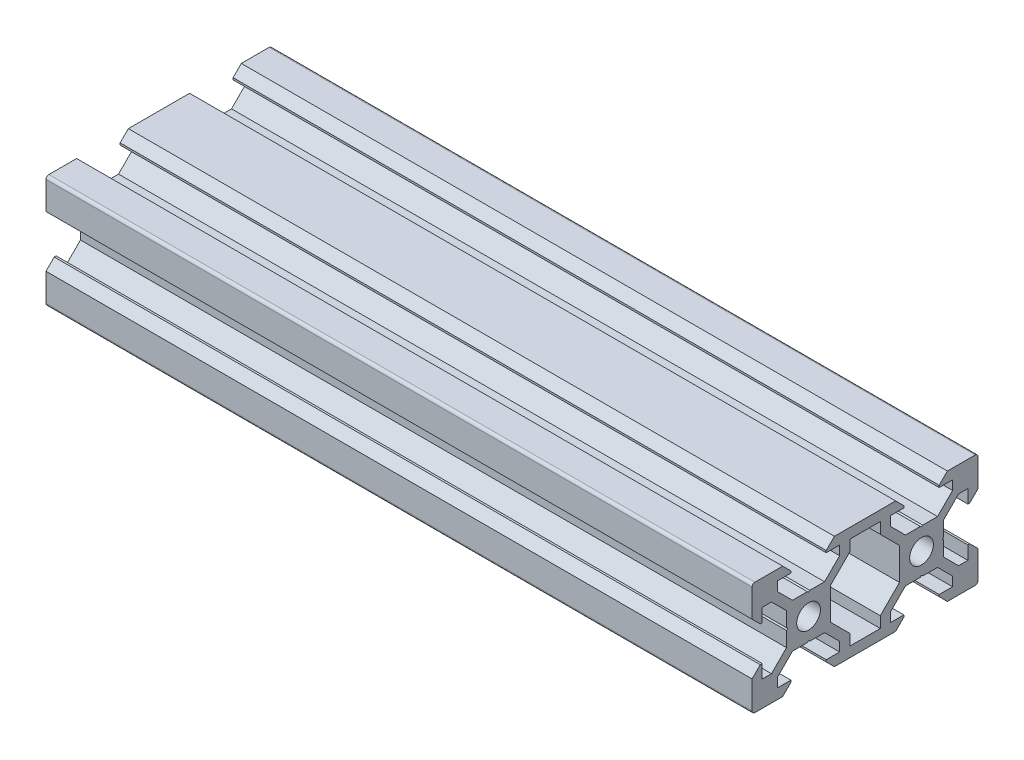
from build123d import *

# Parameters (mm, degrees)
PROFILE_SKETCH_R      = 2.1
PROFILE_EXTRUDE_DEPTH = 125


with BuildPart() as part:
    # Profile Sketch → Profile Extrude (new body)
    with BuildSketch(Plane(origin=(0, 0, 0), x_dir=(0, 0, -1), z_dir=(1, 0, 0))):
        with BuildLine():
            Line((5.42, 10), (-5.42, 10))
            Line((-5.42, 10), (-6.875, 8.545))
            Line((-6.875, 8.545), (-6.875, 8.2))
            Line((-6.875, 8.2), (-4.5, 8.2))
            Line((-4.5, 8.2), (-4.5, 6.56))
            Line((-4.5, 6.56), (-7.16, 3.9))
            Line((-7.16, 3.9), (-9.79, 3.9))
            Line((-9.79, 3.9), (-10, 3.69))
            Line((-10, 3.69), (-10.21, 3.9))
            Line((-10.21, 3.9), (-12.84, 3.9))
            Line((-12.84, 3.9), (-15.5, 6.56))
            Line((-15.5, 6.56), (-15.5, 8.2))
            Line((-15.5, 8.2), (-13.125, 8.2))
            Line((-13.125, 8.2), (-13.125, 8.545))
            Line((-13.125, 8.545), (-14.58, 10))
            Line((-14.58, 10), (-19.5, 10))
            ThreePointArc((-19.5, 10), (-19.853553391, 9.853553391), (-20, 9.5))
            Line((-20, 9.5), (-20, 4.58))
            Line((-20, 4.58), (-18.545, 3.125))
            Line((-18.545, 3.125), (-18.2, 3.125))
            Line((-18.2, 3.125), (-18.2, 5.5))
            Line((-18.2, 5.5), (-16.56, 5.5))
            Line((-16.56, 5.5), (-13.9, 2.838679656))
            Line((-13.9, 2.838679656), (-13.9, 0.21))
            Line((-13.9, 0.21), (-13.69, 0))
            Line((-13.69, 0), (-13.9, -0.21))
            Line((-13.9, -0.21), (-13.9, -2.838679656))
            Line((-13.9, -2.838679656), (-16.56, -5.5))
            Line((-16.56, -5.5), (-18.2, -5.5))
            Line((-18.2, -5.5), (-18.2, -3.125))
            Line((-18.2, -3.125), (-18.545, -3.125))
            Line((-18.545, -3.125), (-20, -4.58))
            Line((-20, -4.58), (-20, -9.5))
            ThreePointArc((-20, -9.5), (-19.853553391, -9.853553391), (-19.5, -10))
            Line((-19.5, -10), (-14.58, -10))
            Line((-14.58, -10), (-13.125, -8.545))
            Line((-13.125, -8.545), (-13.125, -8.2))
            Line((-13.125, -8.2), (-15.5, -8.2))
            Line((-15.5, -8.2), (-15.5, -6.56))
            Line((-15.5, -6.56), (-12.84, -3.9))
            Line((-12.84, -3.9), (-10.21, -3.9))
            Line((-10.21, -3.9), (-10, -3.69))
            Line((-10, -3.69), (-9.79, -3.9))
            Line((-9.79, -3.9), (-7.16, -3.9))
            Line((-7.16, -3.9), (-4.5, -6.56))
            Line((-4.5, -6.56), (-4.5, -8.2))
            Line((-4.5, -8.2), (-6.875, -8.2))
            Line((-6.875, -8.2), (-6.875, -8.545))
            Line((-6.875, -8.545), (-5.42, -10))
            Line((-5.42, -10), (5.42, -10))
            Line((5.42, -10), (6.875, -8.545))
            Line((6.875, -8.545), (6.875, -8.2))
            Line((6.875, -8.2), (4.5, -8.2))
            Line((4.5, -8.2), (4.5, -6.56))
            Line((4.5, -6.56), (7.16, -3.9))
            Line((7.16, -3.9), (9.79, -3.9))
            Line((9.79, -3.9), (10, -3.69))
            Line((10, -3.69), (10.21, -3.9))
            Line((10.21, -3.9), (12.84, -3.9))
            Line((12.84, -3.9), (15.5, -6.56))
            Line((15.5, -6.56), (15.5, -8.2))
            Line((15.5, -8.2), (13.125, -8.2))
            Line((13.125, -8.2), (13.125, -8.545))
            Line((13.125, -8.545), (14.58, -10))
            Line((14.58, -10), (19.5, -10))
            ThreePointArc((19.5, -10), (19.853553391, -9.853553391), (20, -9.5))
            Line((20, -9.5), (20, -4.58))
            Line((20, -4.58), (18.545, -3.125))
            Line((18.545, -3.125), (18.2, -3.125))
            Line((18.2, -3.125), (18.2, -5.5))
            Line((18.2, -5.5), (16.56, -5.5))
            Line((16.56, -5.5), (13.9, -2.838679656))
            Line((13.9, -2.838679656), (13.9, -0.21))
            Line((13.9, -0.21), (13.69, 0))
            Line((13.69, 0), (13.9, 0.21))
            Line((13.9, 0.21), (13.9, 2.838679656))
            Line((13.9, 2.838679656), (16.56, 5.5))
            Line((16.56, 5.5), (18.2, 5.5))
            Line((18.2, 5.5), (18.2, 3.125))
            Line((18.2, 3.125), (18.545, 3.125))
            Line((18.545, 3.125), (20, 4.58))
            Line((20, 4.58), (20, 9.5))
            ThreePointArc((20, 9.5), (19.853553391, 9.853553391), (19.5, 10))
            Line((19.5, 10), (14.58, 10))
            Line((14.58, 10), (13.125, 8.545))
            Line((13.125, 8.545), (13.125, 8.2))
            Line((13.125, 8.2), (15.5, 8.2))
            Line((15.5, 8.2), (15.5, 6.56))
            Line((15.5, 6.56), (12.84, 3.9))
            Line((12.84, 3.9), (10.21, 3.9))
            Line((10.21, 3.9), (10, 3.69))
            Line((10, 3.69), (9.79, 3.9))
            Line((9.79, 3.9), (7.16, 3.9))
            Line((7.16, 3.9), (4.5, 6.56))
            Line((4.5, 6.56), (4.5, 8.2))
            Line((4.5, 8.2), (6.875, 8.2))
            Line((6.875, 8.2), (6.875, 8.545))
            Line((6.875, 8.545), (5.42, 10))
        make_face()
        with Locations((-10, 0)):
            Circle(PROFILE_SKETCH_R, mode=Mode.SUBTRACT)
        with Locations((10, 0)):
            Circle(PROFILE_SKETCH_R, mode=Mode.SUBTRACT)
        Polygon((2.7, 8.2), (-2.7, 8.2), (-2.7, 6.238679656), (-6.1, 2.838679656), (-6.1, -0.21), (-6.1, -2.838679656), (-2.7, -6.238679656), (-2.7, -8.2), (2.7, -8.2), (2.7, -6.238679656), (6.1, -2.838679656), (6.1, -0.21), (6.1, 2.838679656), (2.7, 6.238679656), align=None, mode=Mode.SUBTRACT)
    extrude(amount=PROFILE_EXTRUDE_DEPTH)


solid = part.part
